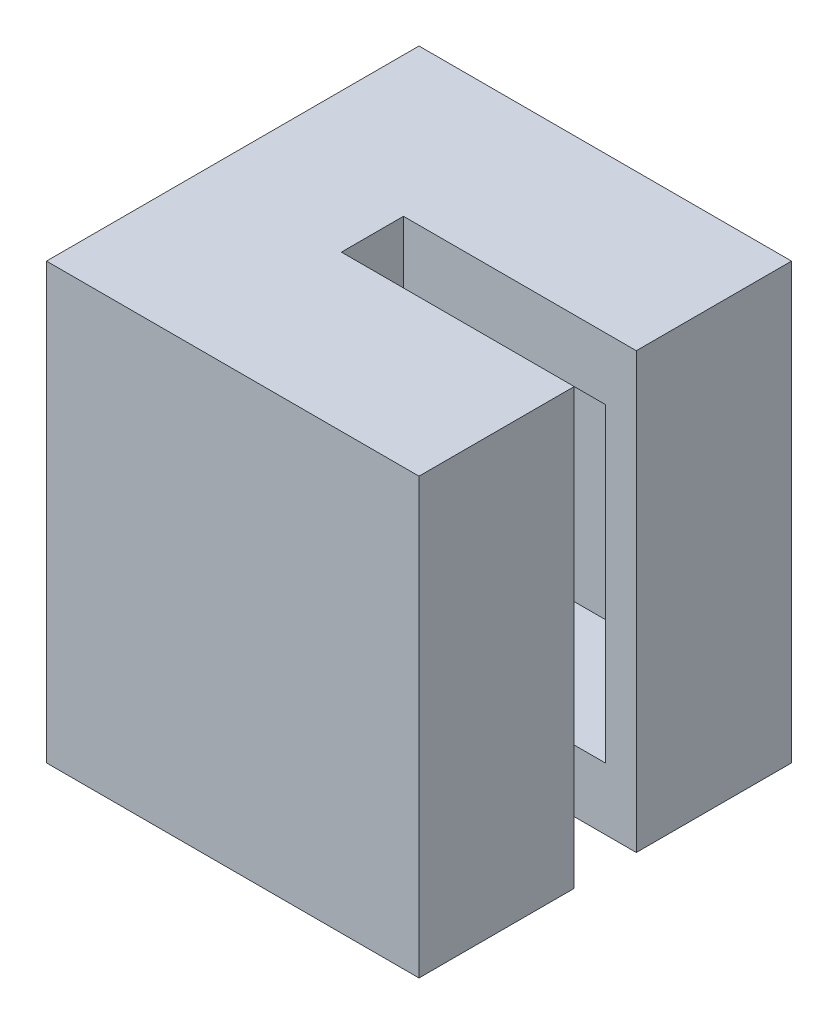
from build123d import *

# Parameters (mm, degrees)
SKETCH2_W           = 120
SKETCH2_H           = 120
SKETCH2_W_2         = 100
SKETCH2_H_2         = 100
BOSS_EXTRUDE1_DEPTH = 100
SKETCH3_W           = 120
SKETCH3_H           = 120
BOSS_EXTRUDE2_DEPTH = 20
SKETCH4_W           = 120
SKETCH4_H           = 120
BOSS_EXTRUDE3_DEPTH = 20
SKETCH5_W           = 75
SKETCH5_H           = 20
CUT_EXTRUDE1_DEPTH  = 150


with BuildPart() as part:
    # Sketch2 → Boss-Extrude1 (new body)
    with BuildSketch(Plane(origin=(0, 0, 0), x_dir=(1, 0, 0), z_dir=(0, 1, 0))):
        Rectangle(SKETCH2_W, SKETCH2_H)
        Rectangle(SKETCH2_W_2, SKETCH2_H_2, mode=Mode.SUBTRACT)
    extrude(amount=BOSS_EXTRUDE1_DEPTH)

    # Sketch3 → Boss-Extrude2 (add)
    with BuildSketch(Plane.XZ):
        Rectangle(SKETCH3_W, SKETCH3_H)
    extrude(amount=BOSS_EXTRUDE2_DEPTH)

    # Sketch4 → Boss-Extrude3 (add)
    with BuildSketch(Plane(origin=(0, 100, 0), x_dir=(1, 0, 0), z_dir=(0, 1, 0))):
        Rectangle(SKETCH4_W, SKETCH4_H)
    extrude(amount=BOSS_EXTRUDE3_DEPTH)

    # Sketch5 → Cut-Extrude1 (cut)
    with BuildSketch(Plane(origin=(0, 120, 0), x_dir=(1, 0, 0), z_dir=(0, 1, 0))):
        with Locations((22.5, 0)):
            Rectangle(SKETCH5_W, SKETCH5_H)
    extrude(amount=-CUT_EXTRUDE1_DEPTH, mode=Mode.SUBTRACT)


solid = part.part
